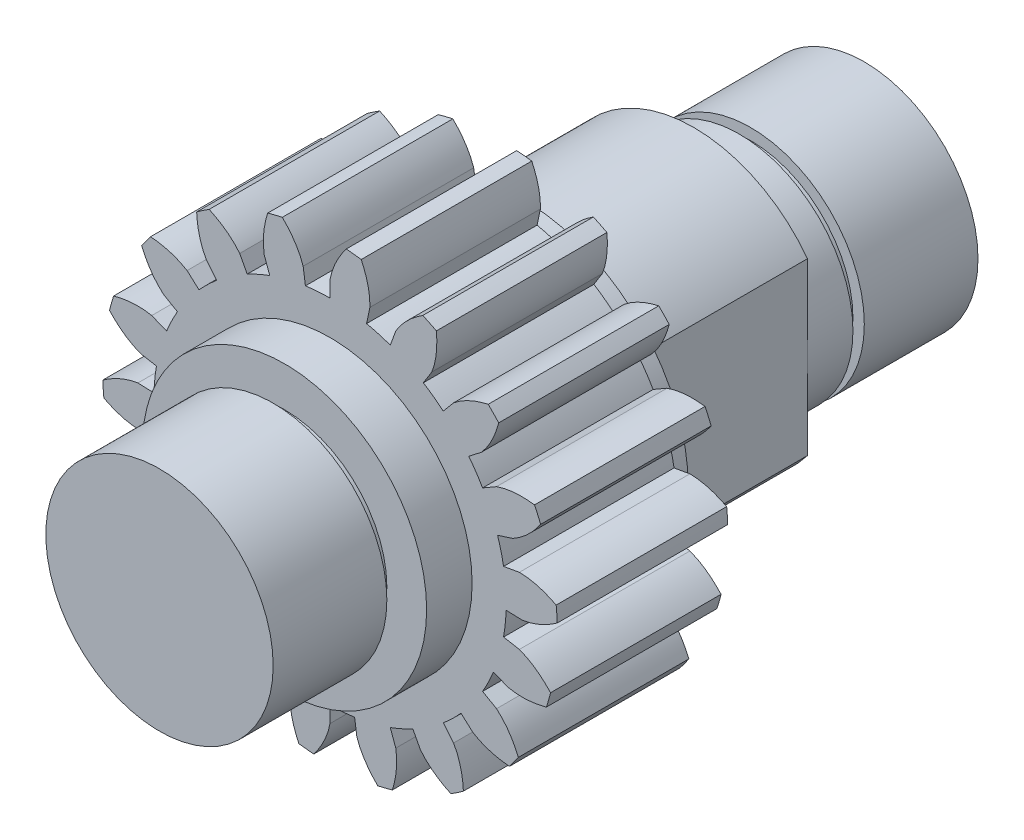
from build123d import *

# Parameters (mm, degrees)
BOSS_EXTRUDE1_DEPTH = 15
CIRPATTERN1_COUNT   = 18
SKETCH3_R           = 12.5
BOSS_EXTRUDE2_DEPTH = 4
SKETCH3_3_R         = 10
BOSS_EXTRUDE3_DEPTH = 15
SKETCH4_W           = 1
SKETCH4_H           = 1
SKETCH5_R           = 14.5
BOSS_EXTRUDE4_DEPTH = 2
BOSS_EXTRUDE5_START = 17
SKETCH5_3_R         = 12.5
BOSS_EXTRUDE5_DEPTH = 17
BOSS_EXTRUDE6_START = 32
SKETCH5_4_R         = 10
BOSS_EXTRUDE6_DEPTH = 32
SKETCH6_W           = 1
SKETCH6_H           = 1
SKETCH7_OUTSIDE_W   = 58.746
SKETCH7_OUTSIDE_H   = 58.672
CUT_EXTRUDE1_DEPTH  = 15


with BuildPart() as part:
    # Sketch1 → Boss-Extrude1 (new body)
    with BuildSketch(Plane.XY):
        with BuildLine():
            ThreePointArc((15.5, 0), (12.043243116, 9.7575763), (3.214800612, 15.162950143))
            Line((3.214800612, 15.162950143), (0.009892906, 0.094334712))
            Line((0.009892906, 0.094334712), (0.000830871, 15.499999978))
            ThreePointArc((0.000830871, 15.499999978), (-10.960448862, -10.959861347), (15.5, 0))
        make_face()
        with BuildLine():
            Line((0.009892906, 0.094334712), (3.214800612, 15.162950143))
            ThreePointArc((3.214800612, 15.162950143), (1.616623675, 15.415463921), (0.000830871, 15.499999978))
            Line((0.000830871, 15.499999978), (0.009892906, 0.094334712))
        make_face()
        with BuildLine():
            add(Edge.make_bspline(
                [(3.508649149, 16.544547059), (3.540351967, 17.681999927), (3.230459728, 18.781780503), (2.744855213, 19.810748846)],
                knots=[0, 0, 0, 0, 0.180679295, 0.180679295, 0.180679295, 0.180679295], degree=3))
            ThreePointArc((2.744855213, 19.810748846), (2.085966032, 19.890921188), (1.424779355, 19.949185542))
            add(Edge.make_bspline(
                [(0, 16.9125), (0.204961672, 18.031783167), (0.736271112, 19.043346706), (1.424779355, 19.949185542)],
                knots=[0, 0, 0, 0, 0.180679295, 0.180679295, 0.180679295, 0.180679295], degree=3))
            Line((0, 16.9125), (0.000830871, 15.499999978))
            ThreePointArc((0.000830871, 15.499999978), (1.616623675, 15.415463921), (3.214800612, 15.162950143))
            Line((3.214800612, 15.162950143), (3.508649149, 16.544547059))
        make_face()
    boss_extrude1 = extrude(amount=BOSS_EXTRUDE1_DEPTH)

    # CirPattern1: Boss-Extrude1 ×18 about axis
    cirpattern1_axis = Axis((0, 0, 15), (0, 0, 1))
    for i in range(1, CIRPATTERN1_COUNT):
        add(boss_extrude1.rotate(cirpattern1_axis, i * 360 / CIRPATTERN1_COUNT))

    # Sketch3 → Boss-Extrude2 (add)
    with BuildSketch(Plane.XY.offset(15)):
        Circle(SKETCH3_R)
    extrude(amount=BOSS_EXTRUDE2_DEPTH)

    # Sketch3<3> → Boss-Extrude3 (add)
    with BuildSketch(Plane.XY.offset(15)):
        Circle(SKETCH3_3_R)
    extrude(amount=BOSS_EXTRUDE3_DEPTH)

    # Sketch4 → Cut-Revolve1 (revolve, cut)
    with BuildSketch(Plane(origin=(0, 0, 0), x_dir=(0, 0, -1), z_dir=(1, 0, 0)), mode=Mode.PRIVATE) as cut_revolve1_sk:
        with Locations((-19.5, 9.5)):
            Rectangle(SKETCH4_W, SKETCH4_H)
    revolve(cut_revolve1_sk.sketch.rotate(Axis((0, 0, 0), (0, 0, -1)), 90), axis=Axis((0, 0, 0), (0, 0, -1)), mode=Mode.SUBTRACT)

    # Sketch5 → Boss-Extrude4 (add)
    with BuildSketch(Plane(origin=(0, 0, 0), x_dir=(-1, 0, 0), z_dir=(0, 0, -1))):
        with Locations(Location((0, 0, 0), (0, 0, 180))):
            Circle(SKETCH5_R)
    extrude(amount=BOSS_EXTRUDE4_DEPTH)

    # Sketch5<3> → Boss-Extrude5 (add)
    with BuildSketch(Plane(origin=(0, 0, 0), x_dir=(-1, 0, 0), z_dir=(0, 0, -1)).offset(BOSS_EXTRUDE5_START)):
        with Locations(Location((0, 0, 0), (0, 0, 180))):
            Circle(SKETCH5_3_R)
    extrude(amount=-BOSS_EXTRUDE5_DEPTH)

    # Sketch5<4> → Boss-Extrude6 (add)
    with BuildSketch(Plane(origin=(0, 0, 0), x_dir=(-1, 0, 0), z_dir=(0, 0, -1)).offset(BOSS_EXTRUDE6_START)):
        with Locations(Location((0, 0, 0), (0, 0, 180))):
            Circle(SKETCH5_4_R)
    extrude(amount=-BOSS_EXTRUDE6_DEPTH)

    # Sketch6 → Cut-Revolve2 (revolve, cut)
    with BuildSketch(Plane(origin=(0, 0, 0), x_dir=(0, 0, -1), z_dir=(1, 0, 0)), mode=Mode.PRIVATE) as cut_revolve2_sk:
        with Locations((21.5, 9.5)):
            Rectangle(SKETCH6_W, SKETCH6_H)
    revolve(cut_revolve2_sk.sketch.rotate(Axis((0, 0, 0), (0, 0, -1)), 90), axis=Axis((0, 0, 0), (0, 0, -1)), mode=Mode.SUBTRACT)

    # Sketch7 outside → Cut-Extrude1 (cut)
    with BuildSketch(Plane(origin=(0, 0, -17), x_dir=(-1, 0, 0), z_dir=(0, 0, -1))):
        Rectangle(SKETCH7_OUTSIDE_W, SKETCH7_OUTSIDE_H)
        with BuildLine():
            Line((-10, 7.5), (-10, -7.5))
            ThreePointArc((-10, -7.5), (0, -12.5), (10, -7.5))
            Line((10, -7.5), (10, 7.5))
            ThreePointArc((10, 7.5), (0, 12.5), (-10, 7.5))
        make_face(mode=Mode.SUBTRACT)
    extrude(amount=-CUT_EXTRUDE1_DEPTH, mode=Mode.SUBTRACT)


solid = part.part
